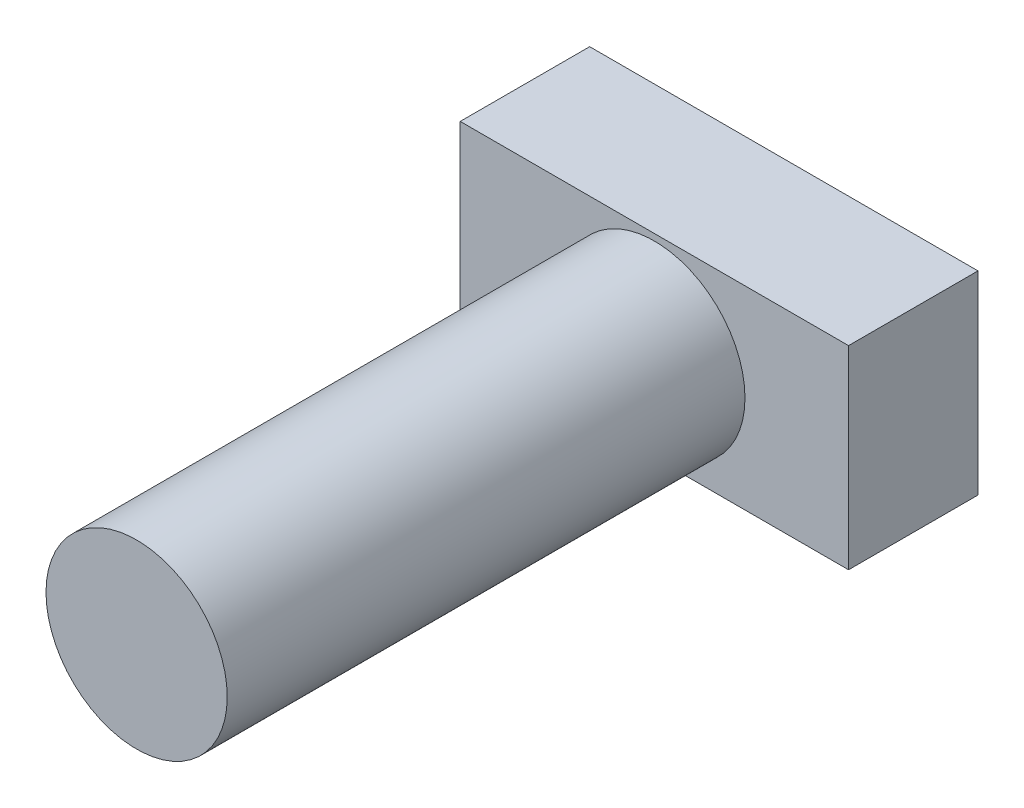
from build123d import *

# Parameters (mm, degrees)
SKETCH1_R           = 7
BOSS_EXTRUDE1_DEPTH = 40
SKETCH2_W           = 30
SKETCH2_H           = 15
BOSS_EXTRUDE2_DEPTH = 10


with BuildPart() as part:
    # Sketch1 → Boss-Extrude1 (new body)
    with BuildSketch(Plane.XY):
        Circle(SKETCH1_R)
    extrude(amount=BOSS_EXTRUDE1_DEPTH)

    # Sketch2 → Boss-Extrude2 (add)
    with BuildSketch(Plane(origin=(0, 0, 0), x_dir=(-1, 0, 0), z_dir=(0, 0, -1))):
        Rectangle(SKETCH2_W, SKETCH2_H)
    extrude(amount=BOSS_EXTRUDE2_DEPTH)


solid = part.part
